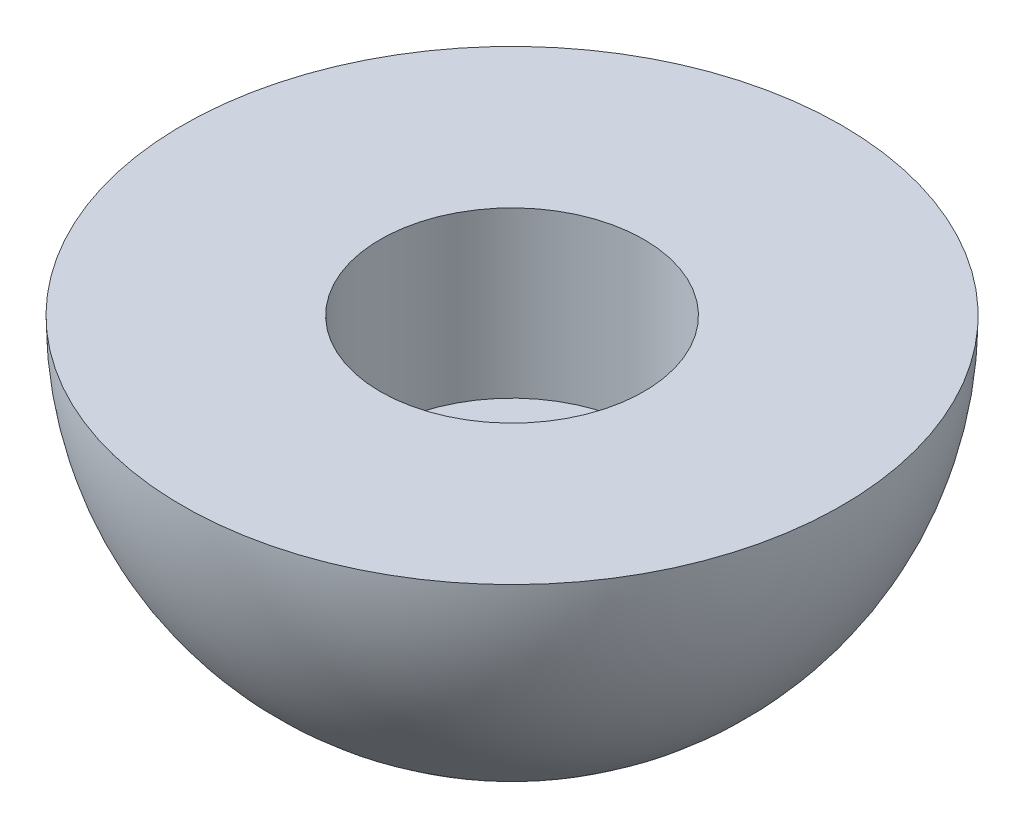
from build123d import *

# Parameters (mm, degrees)
REVOLVE1_ANGLE          = 180
CUT_EXTRUDE1_DEPTH      = 18.320508076
CUT_EXTRUDE1_DEPTH_BACK = 5
SKETCH2_R               = 4


with BuildPart() as part:
    # Sketch1 → Revolve1 (revolve)
    with BuildSketch(Plane(origin=(0, 0, 0), x_dir=(1, 0, 0), z_dir=(0, 1, 0))):
        with BuildLine():
            Line((10, 0), (-10, 0))
            ThreePointArc((-10, 0), (0, 10), (10, 0))
        make_face()
    revolve(axis=Axis((10, 0, 0), (-1, 0, 0)), revolution_arc=REVOLVE1_ANGLE)

    # Sketch2 → Cut-Extrude1 (cut, two sides: drawn at the far end of the back side and taken through both)
    with BuildSketch(Plane(origin=(0, 0, 0), x_dir=(1, 0, 0), z_dir=(0, 1, 0)).offset(-CUT_EXTRUDE1_DEPTH_BACK)):
        with Locations(Location((0, 0, 0), (0, 0, 270))):
            Circle(SKETCH2_R)
    extrude(amount=CUT_EXTRUDE1_DEPTH + CUT_EXTRUDE1_DEPTH_BACK, mode=Mode.SUBTRACT)


solid = part.part
